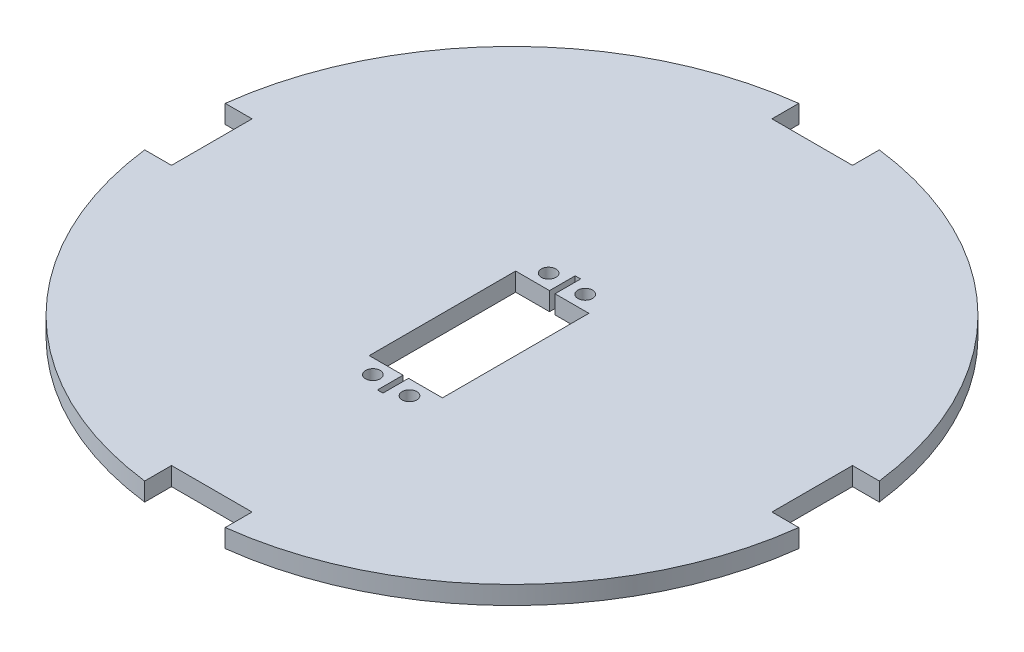
from build123d import *

# Parameters (mm, degrees)
SKETCH1_R           = 90
BOSS_EXTRUDE1_DEPTH = 5
SKETCH2_W           = 22
SKETCH2_H           = 25.485580708
CUT_EXTRUDE1_DEPTH  = 10
CIRPATTERN3_COUNT   = 4
SKETCH3_W           = 1.5
SKETCH3_H           = 7
SKETCH3_R           = 2
CUT_EXTRUDE2_DEPTH  = 10


with BuildPart() as part:
    # Sketch1 → Boss-Extrude1 (new body)
    with BuildSketch(Plane(origin=(0, 0, 0), x_dir=(1, 0, 0), z_dir=(0, 1, 0))):
        with Locations(Location((0, 0, 0), (0, 0, 270))):
            Circle(SKETCH1_R)
    extrude(amount=BOSS_EXTRUDE1_DEPTH)

    # Sketch2 → Cut-Extrude1 (cut)
    with BuildSketch(Plane(origin=(0, 5, 0), x_dir=(1, 0, 0), z_dir=(0, 1, 0))):
        with Locations((0, 94.742790354)):
            Rectangle(SKETCH2_W, SKETCH2_H)
    cut_extrude1 = extrude(amount=-CUT_EXTRUDE1_DEPTH, mode=Mode.SUBTRACT)

    # CirPattern3: Cut-Extrude1 ×4 about axis
    cirpattern3_axis = Axis((0, 0, 0), (0, 1, 0))
    for i in range(1, CIRPATTERN3_COUNT):
        add(cut_extrude1.rotate(cirpattern3_axis, i * 360 / CIRPATTERN3_COUNT), mode=Mode.SUBTRACT)

    # Sketch3 → Cut-Extrude2 (cut)
    with BuildSketch(Plane(origin=(0, 5, 0), x_dir=(1, 0, 0), z_dir=(0, 1, 0))):
        Polygon((10, -9), (-10, -9), (-10, -29), (-0.75, -29), (0.75, -29), (10, -29), align=None)
        with Locations((0, -32.5)):
            Rectangle(SKETCH3_W, SKETCH3_H)
        with Locations(Location((5, -33, 0), (0, 0, 270))):
            Circle(SKETCH3_R)
        with Locations(Location((-5, -33, 0), (0, 0, 270))):
            Circle(SKETCH3_R)
        Polygon((-0.75, 11), (-10, 11), (-10, -9), (10, -9), (10, 11), (0.75, 11), align=None)
        with Locations(Location((-5, 15, 0), (0, 0, 270))):
            Circle(SKETCH3_R)
        with Locations((0, 14.5)):
            Rectangle(SKETCH3_W, SKETCH3_H)
        with Locations(Location((5, 15, 0), (0, 0, 270))):
            Circle(SKETCH3_R)
    extrude(amount=-CUT_EXTRUDE2_DEPTH, mode=Mode.SUBTRACT)


solid = part.part
